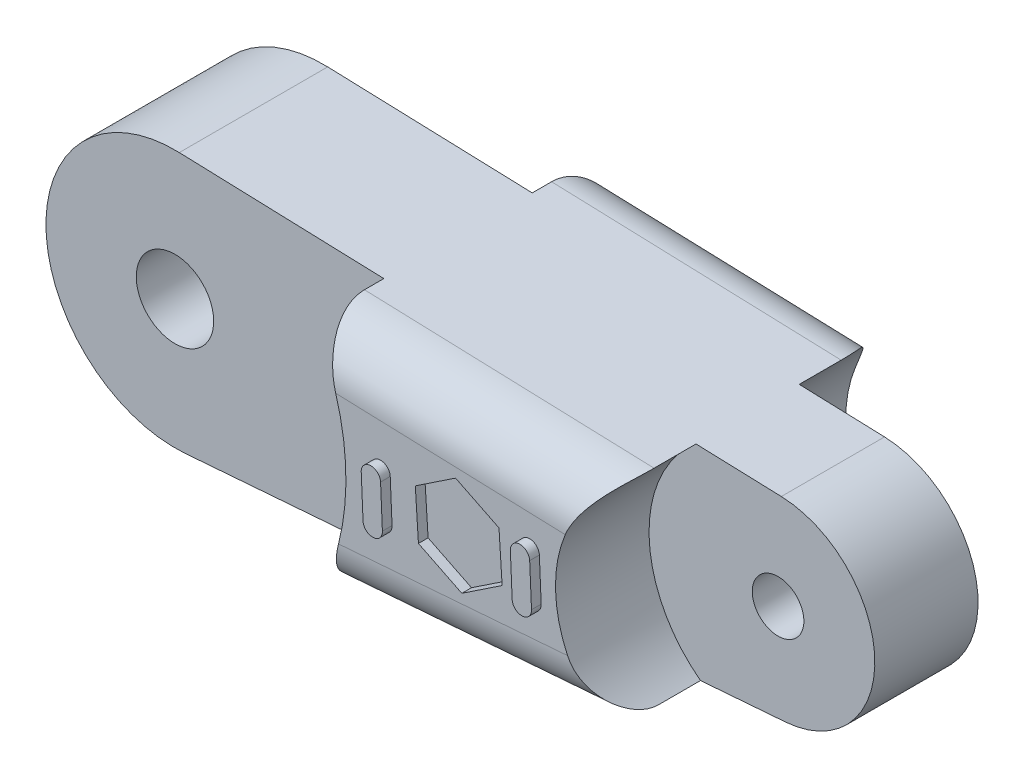
from build123d import *

# Parameters (mm, degrees)
BOSS_EXTRUDE1_DEPTH    = 22.5
SKETCH2_R              = 37.5
SKETCH2_R_2            = 20
CUT_EXTRUDE1_DEPTH     = 11
FILLET1_R              = 8
SKETCH4_R              = 6
SKETCH4_R_2            = 4
CUT_EXTRUDE2_DEPTH     = 40
CUT_EXTRUDE3_DEPTH     = 1.5
BOSS_EXTRUDE2_DEPTH    = 1.5
SKETCH7_R              = 20
CUT_EXTRUDE4_DEPTH     = 3.5
BODY_MOVE_COPY7_ANGLE  = 178.232303169
BODY_MOVE_COPY8_ANGLE  = 1.26
BODY_MOVE_COPY9_ANGLE  = 1.26
BODY_MOVE_COPY10_ANGLE = 180


with BuildPart() as part:
    # Sketch1 → Boss-Extrude1 (new, symmetric)
    with BuildSketch(Plane(origin=(0, 0, 0), x_dir=(1, 0, 0), z_dir=(0, 1, 0))):
        with BuildLine():
            Line((-91.135271219, -13.013928685), (-1.541618241, -19.940496814))
            ThreePointArc((-1.541618241, -19.940496814), (19.99534612, -0.431431984), (-0.680086883, 19.988433701))
            Line((-0.680086883, 19.988433701), (-90.489122701, 16.932769202))
            ThreePointArc((-90.489122701, 16.932769202), (-104.975567128, 2.265017913), (-91.135271219, -13.013928685))
        make_face()
    extrude(amount=BOSS_EXTRUDE1_DEPTH, both=True)

    # Sketch2 → Cut-Extrude1 (cut)
    with BuildSketch(Plane.XZ.offset(22.5)):
        Circle(SKETCH2_R)
        with Locations((-89.979057538, -1.941443926)):
            Circle(SKETCH2_R_2)
    cut_extrude1 = extrude(amount=-CUT_EXTRUDE1_DEPTH, mode=Mode.SUBTRACT)

    # Mirror1: Cut-Extrude1 across plane
    add(cut_extrude1.mirror(Plane(origin=(0, 0, 0), x_dir=(0, 0, 1), z_dir=(0, -1, 0))), mode=Mode.SUBTRACT)

    # Fillet1
    fillet1_edges = [part.edges().sort_by_distance(p)[0] for p in [
        (-55.557279033, -22.5, 15.764496148),
        (-54.825601141, -22.5, -18.1461856),
        (-54.825601141, 22.5, -18.1461856),
        (-55.557279033, 22.5, 15.764496148),
    ]]
    fillet(fillet1_edges, radius=FILLET1_R)

    # Sketch4 → Cut-Extrude2 (cut)
    with BuildSketch(Plane.XZ.offset(11.5)):
        with Locations(Location((0, 0, 0), (0, 0, 270))):
            Circle(SKETCH4_R)
        with Locations(Location((-89.979057538, -1.941443926, 0), (0, 0, 270))):
            Circle(SKETCH4_R_2)
    extrude(amount=-CUT_EXTRUDE2_DEPTH, mode=Mode.SUBTRACT)

    # Sketch5 → Cut-Extrude3 (cut)
    with BuildSketch(Plane(origin=(0, 22.5, 0), x_dir=(1, 0, 0), z_dir=(0, 1, 0))):
        Polygon((-61.556626556, 4.801358237), (-61.398607028, -2.702531632), (-54.82103801, -6.31762764), (-48.401488521, -2.42883378), (-48.559508049, 5.075056088), (-55.137077066, 8.690152097), align=None)
    cut_extrude3 = extrude(amount=-CUT_EXTRUDE3_DEPTH, mode=Mode.SUBTRACT)

    # Sketch6 → Boss-Extrude2 (add)
    with BuildSketch(Plane(origin=(0, 22.5, 0), x_dir=(1, 0, 0), z_dir=(0, 1, 0))):
        with BuildLine():
            Line((-67.627696069, -1.919544043), (-67.627696069, 4.537052574))
            ThreePointArc((-67.627696069, 4.537052574), (-66.127696069, 6.037052574), (-64.627696069, 4.537052574))
            Line((-64.627696069, 4.537052574), (-64.627696069, -1.919544043))
            ThreePointArc((-64.627696069, -1.919544043), (-66.127696069, -3.419544043), (-67.627696069, -1.919544043))
        make_face()
        with BuildLine():
            Line((-44.491273974, -1.919544043), (-44.491273974, 4.537052574))
            ThreePointArc((-44.491273974, 4.537052574), (-42.991273974, 6.037052574), (-41.491273974, 4.537052574))
            Line((-41.491273974, 4.537052574), (-41.491273974, -1.919544043))
            ThreePointArc((-41.491273974, -1.919544043), (-42.991273974, -3.419544043), (-44.491273974, -1.919544043))
        make_face()
    boss_extrude2 = extrude(amount=BOSS_EXTRUDE2_DEPTH)

    # Mirror2: Cut-Extrude3, Boss-Extrude2 across plane
    add(cut_extrude3.mirror(Plane(origin=(0, 0, 0), x_dir=(0, 0, 1), z_dir=(0, -1, 0))), mode=Mode.SUBTRACT)
    add(boss_extrude2.mirror(Plane(origin=(0, 0, 0), x_dir=(0, 0, 1), z_dir=(0, -1, 0))))

    # Sketch7 → Cut-Extrude4 (cut)
    with BuildSketch(Plane.XZ.offset(11.5)):
        with Locations((-89.979057538, -1.941443926)):
            Circle(SKETCH7_R)
    cut_extrude4 = extrude(amount=-CUT_EXTRUDE4_DEPTH, mode=Mode.SUBTRACT)

    # Mirror3: Cut-Extrude4 across plane
    add(cut_extrude4.mirror(Plane.ZX), mode=Mode.SUBTRACT)


with BuildPart() as part_1:
    # Body-Move/Copy1: moved
    add(part.part.moved(Location((89.979057538, 0, 1.941443926))))


with BuildPart() as part_2:
    # Body-Move/Copy7: moved
    add(part_1.part.rotate(Axis((0, 0, 0), (-0.01542728866789555, -0.7070226300353892, 0.7070226300354173)), BODY_MOVE_COPY7_ANGLE))


with BuildPart() as part_3:
    # Body-Move/Copy8: moved
    add(part_2.part.rotate(Axis((0, 0, 0), (0, 0, -1)), BODY_MOVE_COPY8_ANGLE))


with BuildPart() as part_4:
    # Body-Move/Copy9: moved
    add(part_3.part.rotate(Axis((0, 0, 0), (0, 0, 1)), BODY_MOVE_COPY9_ANGLE))


with BuildPart() as part_5:
    # Body-Move/Copy10: moved
    add(part_4.part.rotate(Axis((0, 0, 0), (1, 0, 0)), BODY_MOVE_COPY10_ANGLE))


solid = part_5.part
